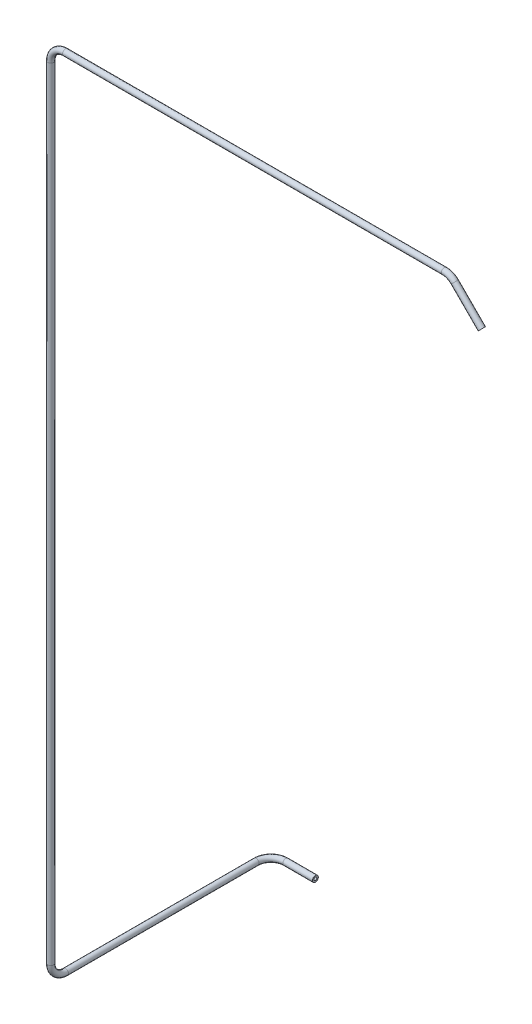
from build123d import *

# Parameters (mm, degrees)
SKETCH4_R   = 2
SKETCH4_R_2 = 1


with BuildPart() as part:
    # Sweep2: sweep along a curve in space
    with BuildLine() as sweep2_path:
        Line((0, 0, 0), (-18.284271247, 18.284271247, 0))
        ThreePointArc((-18.284271247, 18.284271247, 0), (-21.528504736, 20.451998761, 0), (-25.355339059, 21.213203436, 0))
        Line((-25.355339059, 21.213203436, 0), (-281.213203436, 21.213203436, 0))
        ThreePointArc((-281.213203436, 21.213203436, 0), (-288.284271247, 18.284271247, 0), (-291.213203436, 11.213203436, 0))
        Line((-291.213203436, 11.213203436, 0), (-291.213203436, -516.706796564, 0))
        ThreePointArc((-291.213203436, -516.706796564, 0), (-291.213203436, -523.777864376, -2.928932188), (-291.213203436, -526.706796564, -10))
        Line((-291.213203436, -526.706796564, -10), (-291.213203436, -526.706796564, -138.77))
        ThreePointArc((-291.213203436, -526.706796564, -138.77), (-288.284271247, -526.706796564, -145.841067812), (-281.213203436, -526.706796564, -148.77))
        Line((-281.213203436, -526.706796564, -148.77), (-261.213203436, -526.706796564, -148.77))
    # Sketch4 → Sweep2 (sweep)
    with BuildSketch(Plane(origin=(0, 0, 0), x_dir=(0, 0, 1), z_dir=(-0.7071067811865488, 0.7071067811865464, 0))):
        Circle(SKETCH4_R)
        Circle(SKETCH4_R_2, mode=Mode.SUBTRACT)
    sweep(path=sweep2_path.line)


solid = part.part
